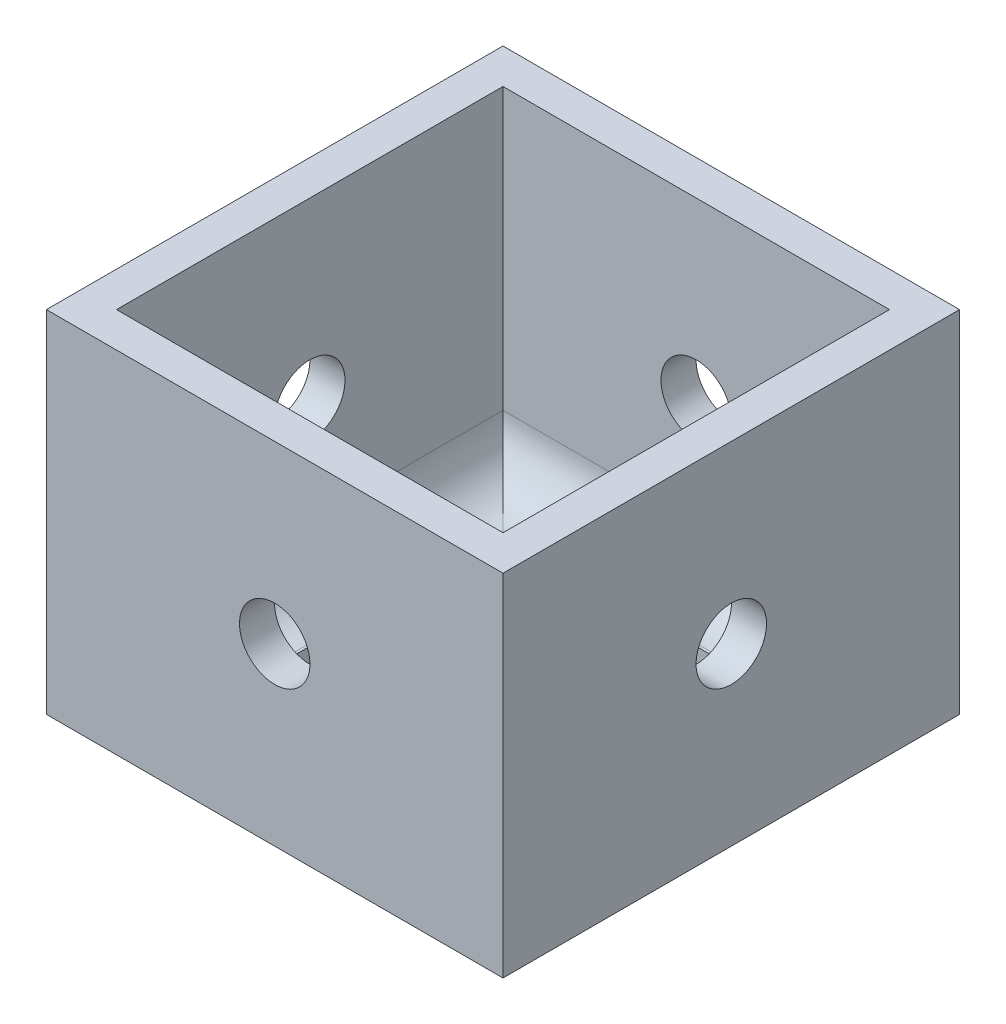
from build123d import *

# Parameters (mm, degrees)
SKETCH1_W           = 33.08
SKETCH1_H           = 33.08
SKETCH1_W_2         = 28
SKETCH1_H_2         = 28
EXTRUDE_THIN1_DEPTH = 25.4
CIRPATTERN1_COUNT   = 4
SKETCH1_3_W         = 28
SKETCH1_3_H         = 28
SKETCH1_3_W_2       = 20
SKETCH1_3_H_2       = 20
BOSS_EXTRUDE1_DEPTH = 1.27
FILLET1_R           = 3.81


with BuildPart() as part:
    # Sketch1 → Extrude-Thin1 (new body)
    with BuildSketch(Plane(origin=(0, 0, 0), x_dir=(1, 0, 0), z_dir=(0, 1, 0))):
        with Locations((14, 14)):
            Rectangle(SKETCH1_W, SKETCH1_H)
        with Locations((14, 14)):
            Rectangle(SKETCH1_W_2, SKETCH1_H_2, mode=Mode.SUBTRACT)
    extrude(amount=EXTRUDE_THIN1_DEPTH)

    # Sketch9 → Tap Drill for 1/4-20 Tap2 (revolve, cut)
    with BuildSketch(Plane(origin=(14, 12.7, 2.54), x_dir=(0, -1, 0), z_dir=(1, 0, 0))):
        Polygon((0, 0), (0, 9.153816902), (2.5527, 7.62), (2.5527, 0), align=None)
    tap_drill_for_1_4_20_tap2 = revolve(axis=Axis((14, 12.7, 8.89), (0, 0, -1)), mode=Mode.SUBTRACT)

    # CirPattern1: Tap Drill for 1/4-20 Tap2 ×4 about axis
    cirpattern1_axis = Axis((14, -1.27, -14), (0, 1, 0))
    for i in range(1, CIRPATTERN1_COUNT):
        add(tap_drill_for_1_4_20_tap2.rotate(cirpattern1_axis, i * 360 / CIRPATTERN1_COUNT), mode=Mode.SUBTRACT)

    # Sketch1<3> → Boss-Extrude1 (add)
    with BuildSketch(Plane(origin=(0, 0, 0), x_dir=(1, 0, 0), z_dir=(0, 1, 0))):
        with Locations((14, 14)):
            Rectangle(SKETCH1_3_W, SKETCH1_3_H)
        with Locations((14, 14)):
            Rectangle(SKETCH1_3_W_2, SKETCH1_3_H_2, mode=Mode.SUBTRACT)
    extrude(amount=BOSS_EXTRUDE1_DEPTH)

    # Fillet1
    fillet1_edges = [part.edges().sort_by_distance(p)[0] for p in [
        (14, 1.27, -28),
        (0, 1.27, -14),
        (14, 1.27, 0),
        (28, 1.27, -14),
    ]]
    fillet(fillet1_edges, radius=FILLET1_R)


solid = part.part
